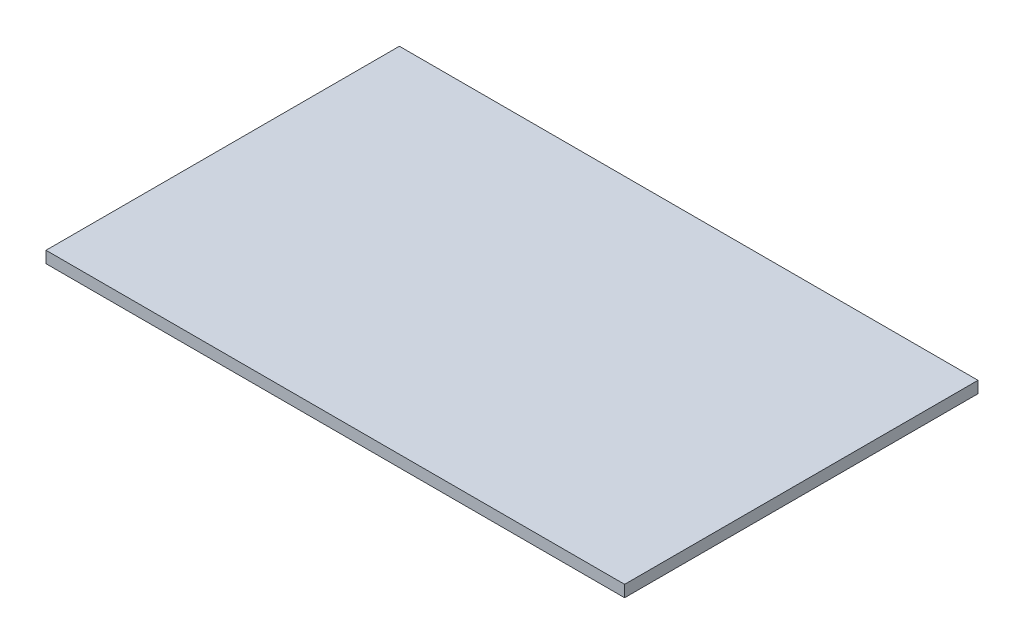
from build123d import *

# Parameters (mm, degrees)
SKETCH1_W           = 946.15
SKETCH1_H           = 577.85
BOSS_EXTRUDE1_DEPTH = 19.05


with BuildPart() as part:
    # Sketch1 → Boss-Extrude1 (new body)
    with BuildSketch(Plane(origin=(0, 0, 0), x_dir=(1, 0, 0), z_dir=(0, 1, 0))):
        with Locations((473.075, 288.925)):
            Rectangle(SKETCH1_W, SKETCH1_H)
    extrude(amount=BOSS_EXTRUDE1_DEPTH)


solid = part.part
